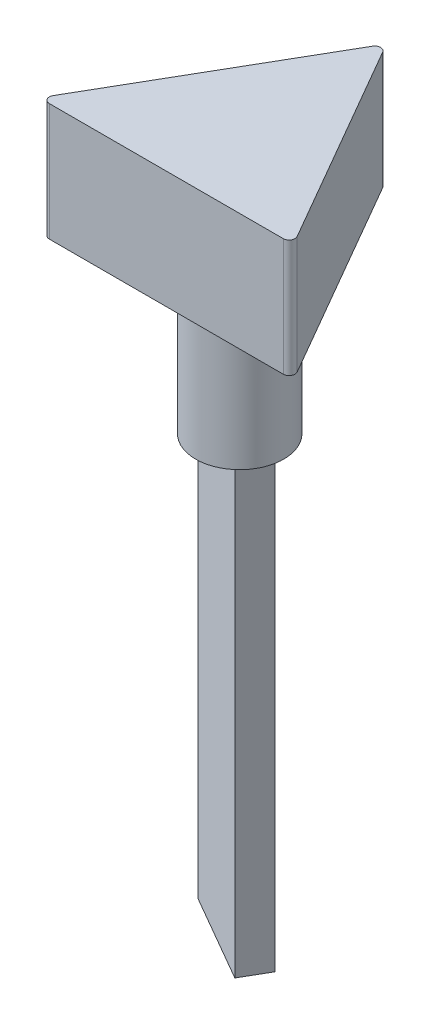
from build123d import *

# Parameters (mm, degrees)
EXTRUDE_1_DEPTH = 4
SKETCH_2_R      = 1.5
EXTRUDE_2_DEPTH = 5
EXTRUDE_3_DEPTH = 15


with BuildPart() as part:
    # 草图1 → 凸台-拉伸1 (new body)
    with BuildSketch(Plane(origin=(0, 0, 0), x_dir=(1, 0, 0), z_dir=(0, 1, 0))):
        with BuildLine():
            Line((-0.173205081, 4.7), (-4.156921938, -2.2))
            ThreePointArc((-4.156921938, -2.2), (-4.156921938, -2.4), (-3.983716857, -2.5))
            Line((-3.983716857, -2.5), (3.983716857, -2.5))
            ThreePointArc((3.983716857, -2.5), (4.156921938, -2.4), (4.156921938, -2.2))
            Line((4.156921938, -2.2), (0.173205081, 4.7))
            ThreePointArc((0.173205081, 4.7), (0, 4.8), (-0.173205081, 4.7))
        make_face()
    extrude(amount=EXTRUDE_1_DEPTH)

    # 草图2 → 凸台-拉伸2 (add)
    with BuildSketch(Plane.XZ):
        with Locations(Location((0, 0, 0), (0, 0, 90))):
            Circle(SKETCH_2_R)
    extrude(amount=EXTRUDE_2_DEPTH)

    # 草图3 → 凸台-拉伸3 (add)
    with BuildSketch(Plane.XZ.offset(5)):
        Polygon((-1.982050808, -0.566987298), (0.974744871, 1.140119483), (1.474744871, 0.274094079), (-1.482050808, -1.433012702), align=None)
    extrude(amount=EXTRUDE_3_DEPTH)


solid = part.part
